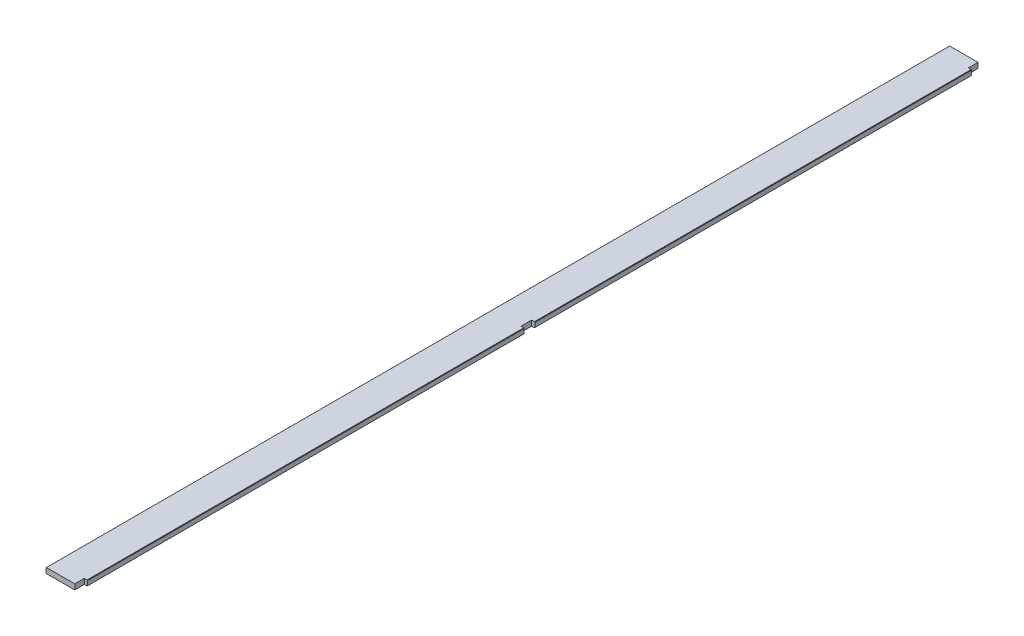
from build123d import *

# Parameters (mm, degrees)
EXTRUDE_1_DEPTH     = 4240
SKETCH_2_W          = 15
SKETCH_2_H          = 45
SKETCH_2_H_2        = 50
CUT_EXTRUDE_1_DEPTH = 4241.736964255


with BuildPart() as part:
    # Эскиз1 → Бобышка-Вытянуть1 (new body)
    with BuildSketch(Plane.XY):
        Polygon((-75, 10.5), (-73, 12.5), (73, 12.5), (75, 10.5), (75, -10.5), (73, -12.5), (-73, -12.5), (-75, -10.5), align=None)
    extrude(amount=EXTRUDE_1_DEPTH)

    # Эскиз2 → Вырез-Вытянуть1 (cut, through all)
    with BuildSketch(Plane(origin=(0, 12.5, 0), x_dir=(1, 0, 0), z_dir=(0, 1, 0))):
        with Locations((67.5, -22.5)):
            Rectangle(SKETCH_2_W, SKETCH_2_H)
        with Locations((67.5, -4217.5)):
            Rectangle(SKETCH_2_W, SKETCH_2_H)
        with Locations((67.5, -2120)):
            Rectangle(SKETCH_2_W, SKETCH_2_H_2)
    extrude(amount=-CUT_EXTRUDE_1_DEPTH, mode=Mode.SUBTRACT)


solid = part.part
